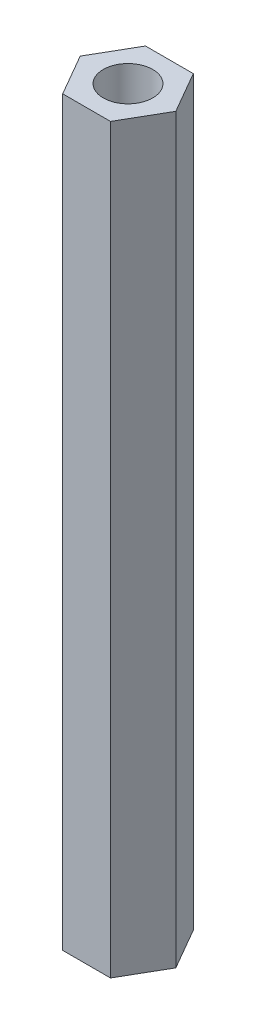
from build123d import *

# Parameters (mm, degrees)
SALIENTE_EXTRUIR2_DEPTH = 45
CROQUIS2_R              = 1.5
CORTAR_EXTRUIR1_DEPTH   = 45


with BuildPart() as part:
    # Croquis1 → Saliente-Extruir2 (new body)
    with BuildSketch(Plane(origin=(0, 0, 0), x_dir=(1, 0, 0), z_dir=(0, 1, 0))):
        Polygon((2.9, 0), (1.45, 2.511473671), (-1.45, 2.511473671), (-2.9, 0), (-1.45, -2.511473671), (1.45, -2.511473671), align=None)
    extrude(amount=SALIENTE_EXTRUIR2_DEPTH)

    # Croquis2 → Cortar-Extruir1 (cut)
    with BuildSketch(Plane(origin=(0, 45, 0), x_dir=(1, 0, 0), z_dir=(0, 1, 0))):
        with Locations(Location((0, 0, 0), (0, 0, 270))):
            Circle(CROQUIS2_R)
    extrude(amount=-CORTAR_EXTRUIR1_DEPTH, mode=Mode.SUBTRACT)


solid = part.part
